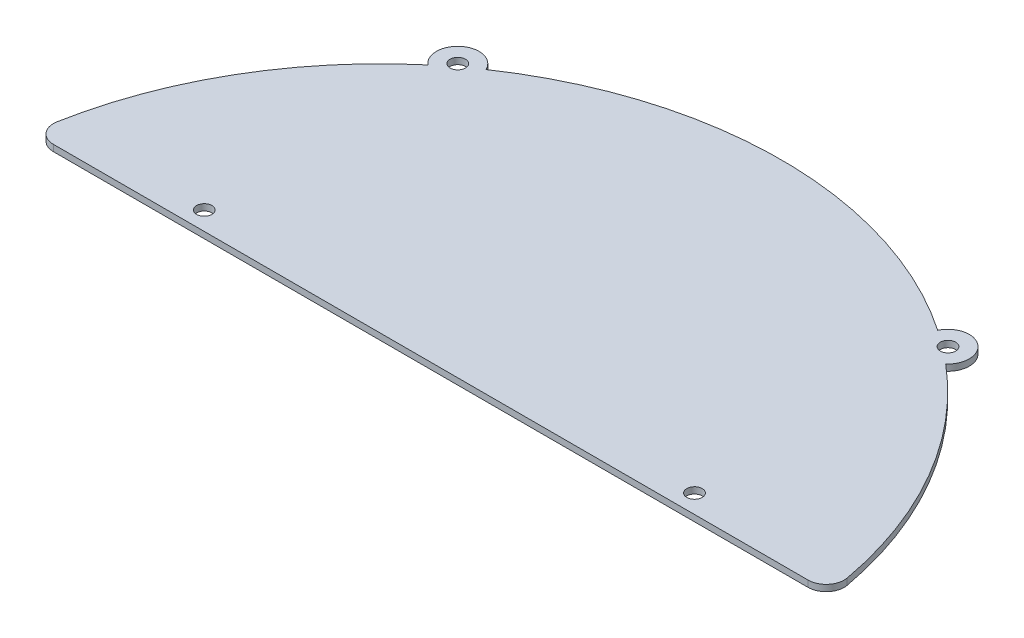
from build123d import *
from build123d.topology import SkipClean

# Parameters (mm, degrees)
BOSS_EXTRU_1_DEPTH      = 1.524
CONG_1_R                = 4.318
BOSS_EXTRU_3_START      = -1.524
BOSS_EXTRU_3_DEPTH      = 1.524
ESQUISSE3_R             = 1.8415
ENL_V_MAT_EXTRU_1_DEPTH = 127.347243097


with BuildPart() as part:
    # Esquisse1 → Boss.-Extru.1 (new body)
    with BuildSketch(Plane(origin=(0, 0, 0), x_dir=(1, 0, 0), z_dir=(0, 1, 0))):
        with BuildLine():
            Line((-95.25, 0), (95.25, 0))
            ThreePointArc((95.25, 0), (0, 83.82), (-95.25, 0))
        make_face()
    extrude(amount=BOSS_EXTRU_1_DEPTH)

    # Congé1
    cong_1_edges = [part.edges().sort_by_distance(p)[0] for p in [
        (-95.25, 0.762, 0),
        (95.25, 0.762, 0),
    ]]
    fillet(cong_1_edges, radius=CONG_1_R)

    # Esquisse2 → Boss.-Extru.3 (add)
    with BuildSketch(Plane(origin=(0, 1.524, 0), x_dir=(1, 0, 0), z_dir=(0, 1, 0)).offset(BOSS_EXTRU_3_START)):
        with BuildLine():
            ThreePointArc((61.910418509, 61.198651621), (61.671752387, 69.100962488), (53.997726446, 67.200224627))
            ThreePointArc((53.997726446, 67.200224627), (55.392549752, 66.233625302), (56.770074378, 65.24252883))
            ThreePointArc((56.770074378, 65.24252883), (59.71468664, 66.520695851), (59.277757535, 63.340515783))
            ThreePointArc((59.277757535, 63.340515783), (60.60355104, 62.281215121), (61.910418509, 61.198651621))
        make_face()
        with BuildLine():
            ThreePointArc((-53.997726446, 67.200224627), (-61.671752387, 69.100962488), (-61.910418509, 61.198651621))
            ThreePointArc((-61.910418509, 61.198651621), (-58.031708887, 64.301796789), (-53.997726446, 67.200224627))
        make_face()
    extrude(amount=BOSS_EXTRU_3_DEPTH)

    # Esquisse3 → Enlèv. mat.-Extru.1 (cut, through all)
    with SkipClean():  # the faces are left unmerged after this step: merging them gives an invalid solid
        with BuildSketch(Plane(origin=(0, 1.524, 0), x_dir=(1, 0, 0), z_dir=(0, 1, 0))):
            with Locations(Location((58.601845334, 65.053485411, 0), (0, 0, 270))):
                Circle(ESQUISSE3_R)
            with Locations(Location((-58.601845334, 65.053485411, 0), (0, 0, 270))):
                Circle(ESQUISSE3_R)
            with Locations(Location((58.601845334, 4.445, 0), (0, 0, 270))):
                Circle(ESQUISSE3_R)
            with Locations(Location((-58.601845334, 4.445, 0), (0, 0, 270))):
                Circle(ESQUISSE3_R)
        extrude(amount=-ENL_V_MAT_EXTRU_1_DEPTH, mode=Mode.SUBTRACT)


solid = part.part
